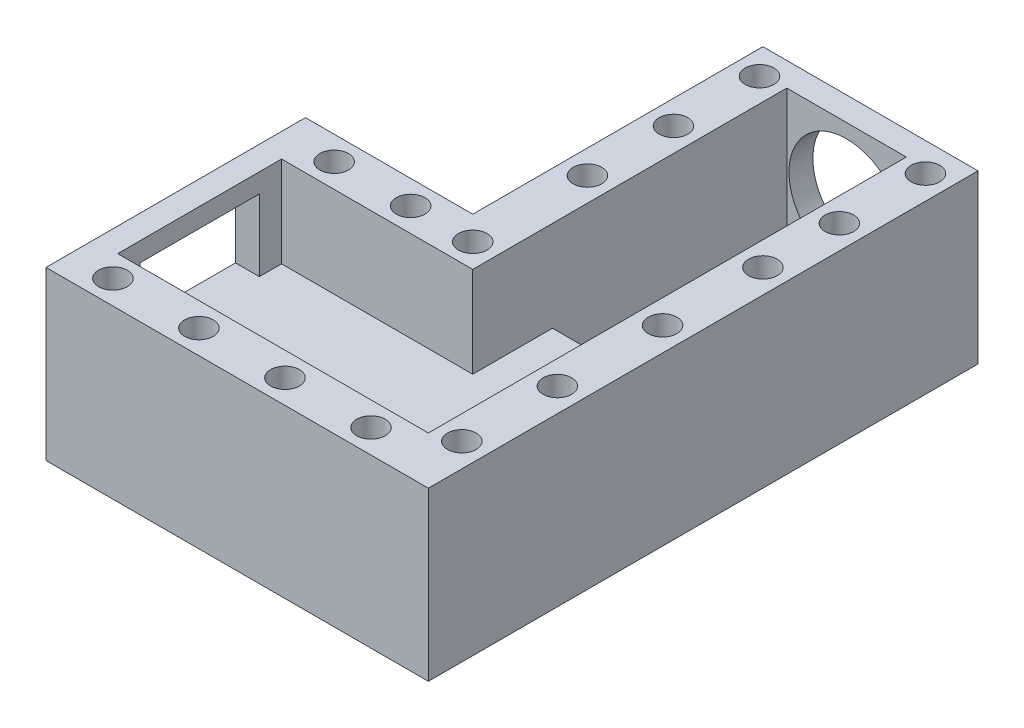
from build123d import *

# Parameters (mm, degrees)
EXTRUDE_1_DEPTH     = 35
EXTRUDE_2_DEPTH     = 5
SKETCH_4_R          = 3
CUT_EXTRUDE_1_DEPTH = 20
SKETCH_6_W          = 25
SKETCH_6_H          = 16.678910785
EXTRUDE_3_DEPTH     = 11
SKETCH_7_W          = 65
SKETCH_7_H          = 34.285714286
EXTRUDE_4_DEPTH     = 11
SKETCH_8_R          = 12.052464441
CUT_EXTRUDE_2_DEPTH = 11
SKETCH_9_W          = 25
SKETCH_9_H          = 15
CUT_EXTRUDE_3_DEPTH = 11


with BuildPart() as part:
    # Эскиз1 → Бобышка-Вытянуть1 (new body)
    with BuildSketch(Plane(origin=(0, 0, 0), x_dir=(1, 0, 0), z_dir=(0, 1, 0))):
        Polygon((-25.991917961, 25.824175824), (0, 25.824175824), (0, 86.538461538), (45, 86.538461538), (45, -28.461538462), (-35, -28.461538462), (-35, 25.824175824), align=None)
        Polygon((-30, -18.461538462), (35, -18.461538462), (35, 21.538461538), (35, 81.538461538), (10, 81.538461538), (10, 15.824175824), (-30, 15.824175824), align=None, mode=Mode.SUBTRACT)
    extrude(amount=EXTRUDE_1_DEPTH)

    # Эскиз3 → Бобышка-Вытянуть2 (add)
    with BuildSketch(Plane.XZ):
        Polygon((35, -81.538461538), (35, 18.461538462), (-30, 18.461538462), (-30, -15.824175824), (10, -15.824175824), (10, -81.538461538), align=None)
    extrude(amount=-EXTRUDE_2_DEPTH)

    # Эскиз4 → Вырез-Вытянуть1 (cut)
    with BuildSketch(Plane(origin=(0, 35, 0), x_dir=(1, 0, 0), z_dir=(0, 1, 0))):
        with Locations(Location((40, 80.538461538, 0), (0, 0, 270))):
            Circle(SKETCH_4_R)
        with Locations(Location((40, 62.538461538, 0), (0, 0, 270))):
            Circle(SKETCH_4_R)
        with Locations(Location((40, 46.538461538, 0), (0, 0, 270))):
            Circle(SKETCH_4_R)
        with Locations(Location((40, 25.538461538, 0), (0, 0, 270))):
            Circle(SKETCH_4_R)
        with Locations(Location((40, 3.538461538, 0), (0, 0, 270))):
            Circle(SKETCH_4_R)
        with Locations(Location((40, -16.461538462, 0), (0, 0, 270))):
            Circle(SKETCH_4_R)
        with Locations(Location((5, 80.824175824, 0), (0, 0, 270))):
            Circle(SKETCH_4_R)
        with Locations(Location((5, 62.824175824, 0), (0, 0, 270))):
            Circle(SKETCH_4_R)
        with Locations(Location((5, 44.824175824, 0), (0, 0, 270))):
            Circle(SKETCH_4_R)
        with Locations(Location((-24, 20.824175824, 0), (0, 0, 270))):
            Circle(SKETCH_4_R)
        with Locations(Location((-8, 20.824175824, 0), (0, 0, 270))):
            Circle(SKETCH_4_R)
        with Locations(Location((5, 20.824175824, 0), (0, 0, 270))):
            Circle(SKETCH_4_R)
        with Locations(Location((-26, -23.461538462, 0), (0, 0, 270))):
            Circle(SKETCH_4_R)
        with Locations(Location((-8, -23.461538462, 0), (0, 0, 270))):
            Circle(SKETCH_4_R)
        with Locations(Location((10, -23.461538462, 0), (0, 0, 270))):
            Circle(SKETCH_4_R)
        with Locations(Location((28, -23.461538462, 0), (0, 0, 270))):
            Circle(SKETCH_4_R)
    extrude(amount=-CUT_EXTRUDE_1_DEPTH, mode=Mode.SUBTRACT)

    # Эскиз6 → Бобышка-Вытянуть3 (add)
    with BuildSketch(Plane(origin=(0, 5, 0), x_dir=(1, 0, 0), z_dir=(0, 1, 0))):
        with Locations((22.5, 24.163631217)):
            Rectangle(SKETCH_6_W, SKETCH_6_H)
    extrude(amount=EXTRUDE_3_DEPTH)

    # Эскиз7 → Бобышка-Вытянуть4 (add)
    with BuildSketch(Plane(origin=(0, 5, 0), x_dir=(1, 0, 0), z_dir=(0, 1, 0))):
        with Locations((2.5, -1.318681319)):
            Rectangle(SKETCH_7_W, SKETCH_7_H)
    extrude(amount=EXTRUDE_4_DEPTH)

    # Эскиз8 → Вырез-Вытянуть2 (cut)
    with BuildSketch(Plane.XY.offset(-81.538461538)):
        with Locations((22.5, 20)):
            Circle(SKETCH_8_R)
    extrude(amount=-CUT_EXTRUDE_2_DEPTH, mode=Mode.SUBTRACT)

    # Эскиз9 → Вырез-Вытянуть3 (cut)
    with BuildSketch(Plane(origin=(-30, 0, 0), x_dir=(0, 0, -1), z_dir=(1, 0, 0))):
        with Locations((-1.318681319, 23.5)):
            Rectangle(SKETCH_9_W, SKETCH_9_H)
    extrude(amount=-CUT_EXTRUDE_3_DEPTH, mode=Mode.SUBTRACT)


solid = part.part
